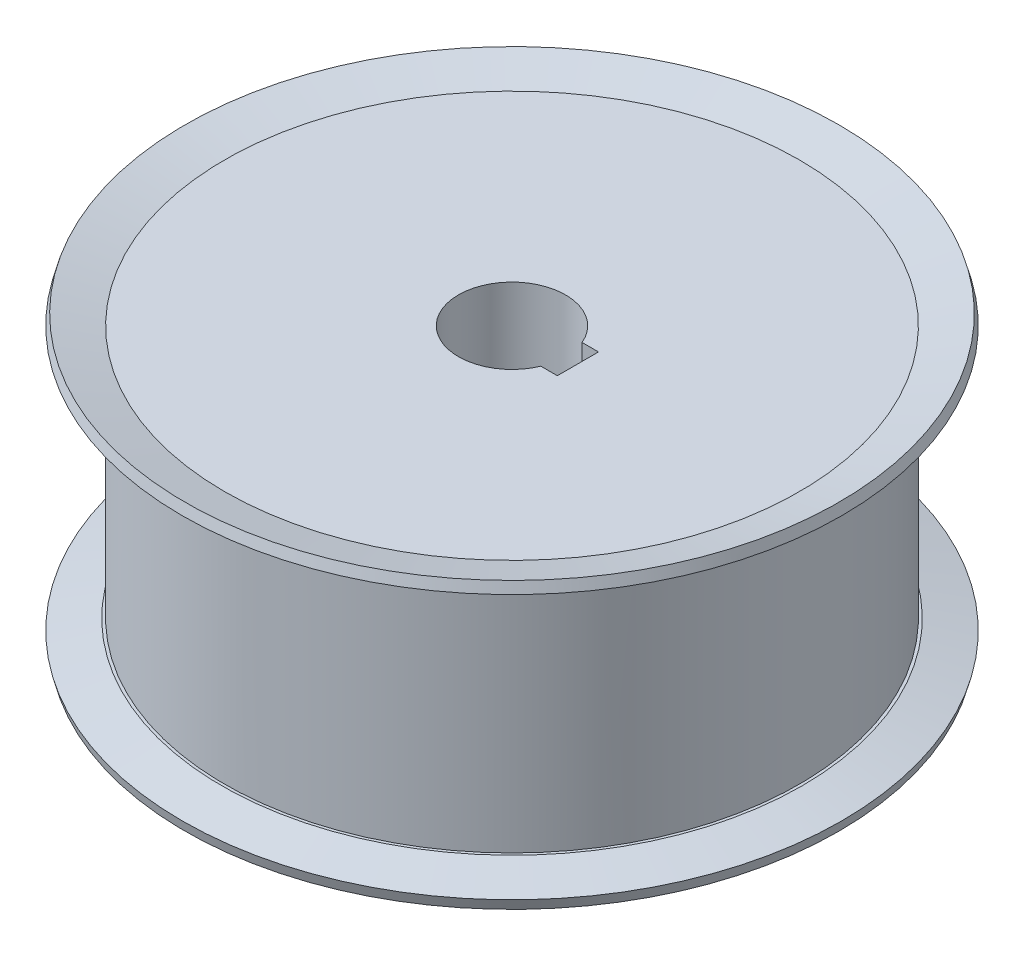
from build123d import *

# Parameters (mm, degrees)
SKETCH_1_R          = 13.95
EXTRUDE_1_DEPTH     = 12.8
CUT_EXTRUDE_1_DEPTH = 20


with BuildPart() as part:
    # 草图1 → 凸台-拉伸1 (new body)
    with BuildSketch(Plane(origin=(0, 0, 0), x_dir=(1, 0, 0), z_dir=(0, 1, 0))):
        with Locations(Location((0, 0, 0), (0, 0, 270))):
            Circle(SKETCH_1_R)
    extrude(amount=EXTRUDE_1_DEPTH)

    # 草图2 → 切除-拉伸1 (cut)
    with BuildSketch(Plane(origin=(0, 12.8, 0), x_dir=(1, 0, 0), z_dir=(0, 1, 0))):
        with BuildLine():
            Line((2.4, 1), (3.2, 1))
            Line((3.2, 1), (3.2, -1))
            Line((3.2, -1), (2.4, -1))
            ThreePointArc((2.4, -1), (-2.6, 0), (2.4, 1))
        make_face()
    extrude(amount=-CUT_EXTRUDE_1_DEPTH, mode=Mode.SUBTRACT)

    # 草图6 → 旋转1 (revolve)
    with BuildSketch(Plane.XY, mode=Mode.PRIVATE) as revolve_1_sk:
        Polygon((12.14125, 12.3), (12.14125, 12.8), (13.95, 12.8), (15.871025404, 13.314737206), (16.005, 12.814737206), (14.083974596, 12.3), align=None)
    revolve(revolve_1_sk.sketch.rotate(Axis((0, 0, 0), (0, 1, 0)), 90), axis=Axis((0, 0, 0), (0, 1, 0)))

    # 草图8 → 旋转2 (revolve)
    with BuildSketch(Plane.XY):
        Polygon((12.14125, 0.5), (12.14125, 0), (13.95, 0), (15.871025404, -0.514737206), (16.005, -0.014737206), (14.083974596, 0.5), align=None)
    revolve(axis=Axis((0, 0, 0), (0, 1, 0)))


solid = part.part
